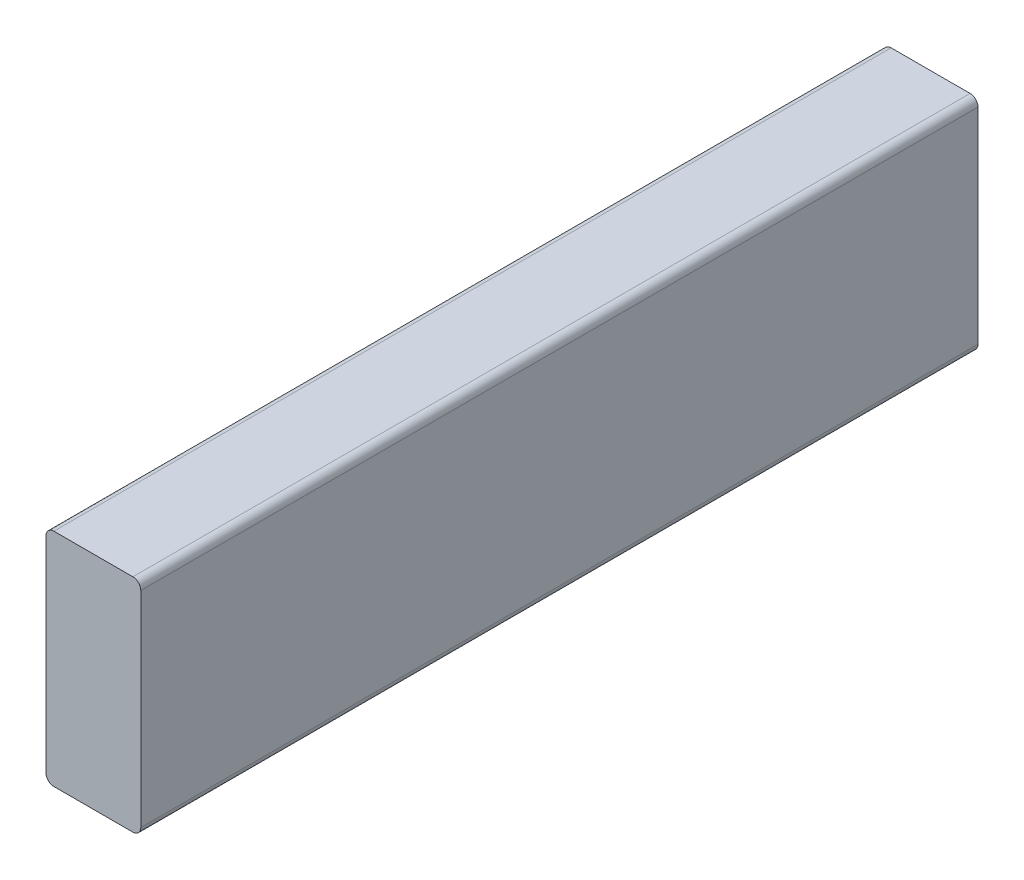
from build123d import *

# Parameters (mm, degrees)
SKETCH1_W           = 38.1
SKETCH1_H           = 88.9
BOSS_EXTRUDE1_DEPTH = 336.55
FILLET1_R           = 3.175


with BuildPart() as part:
    # Sketch1 → Boss-Extrude1 (new body)
    with BuildSketch(Plane.XY):
        Rectangle(SKETCH1_W, SKETCH1_H)
    extrude(amount=-BOSS_EXTRUDE1_DEPTH)

    # Fillet1
    fillet1_edges = [part.edges().sort_by_distance(p)[0] for p in [
        (19.05, -44.45, -168.275),
        (-19.05, -44.45, -168.275),
        (-19.05, 44.45, -168.275),
        (19.05, 44.45, -168.275),
    ]]
    fillet(fillet1_edges, radius=FILLET1_R)


solid = part.part
